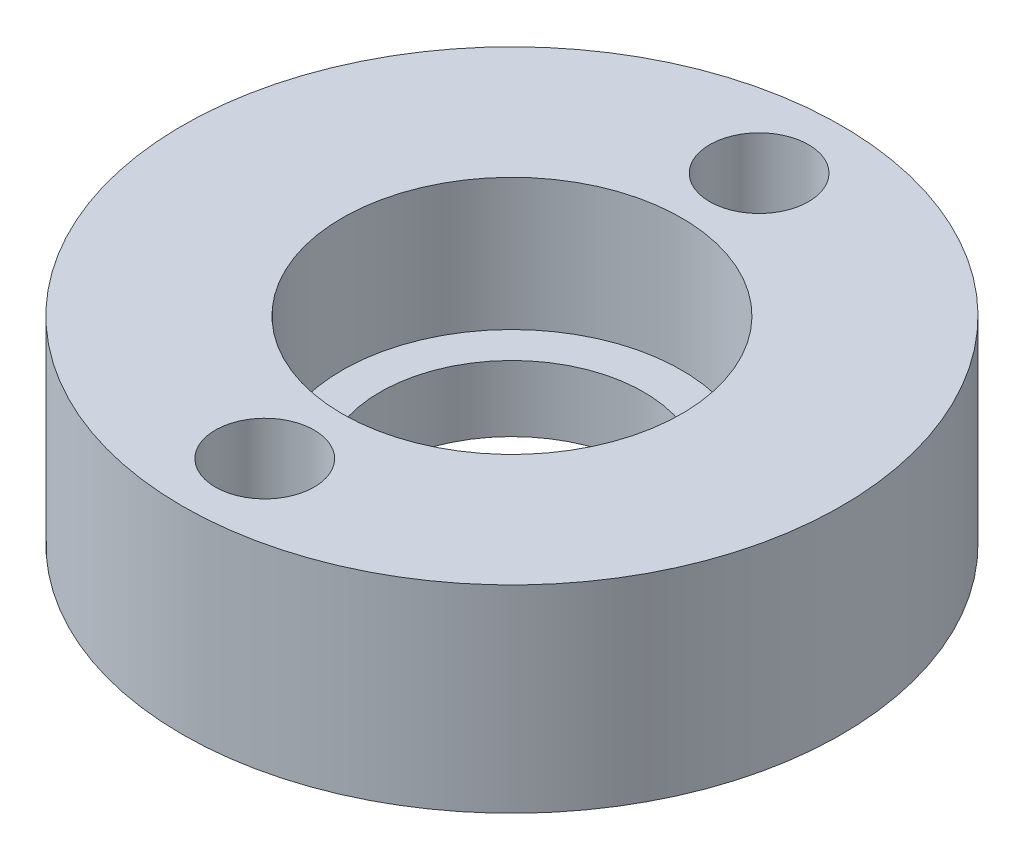
from build123d import *

# Parameters (mm, degrees)
SKETCH_1_R          = 10
SKETCH_1_R_2        = 1.5
SKETCH_1_R_3        = 4
EXTRUDE_1_DEPTH     = 6
SKETCH_2_R          = 5.15
CUT_EXTRUDE_1_DEPTH = 4


with BuildPart() as part:
    # Эскиз1 → Бобышка-Вытянуть1 (new body)
    with BuildSketch(Plane(origin=(0, 0, 0), x_dir=(1, 0, 0), z_dir=(0, 1, 0))):
        with Locations(Location((0, 0, 0), (0, 0, 270))):
            Circle(SKETCH_1_R)
        with Locations(Location((0, 7.5, 0), (0, 0, 270))):
            Circle(SKETCH_1_R_2, mode=Mode.SUBTRACT)
        with Locations(Location((0, -7.5, 0), (0, 0, 270))):
            Circle(SKETCH_1_R_2, mode=Mode.SUBTRACT)
        with Locations(Location((0, 0, 0), (0, 0, 270))):
            Circle(SKETCH_1_R_3, mode=Mode.SUBTRACT)
    extrude(amount=EXTRUDE_1_DEPTH)

    # Эскиз2 → Вырез-Вытянуть1 (cut)
    with BuildSketch(Plane(origin=(0, 6, 0), x_dir=(1, 0, 0), z_dir=(0, 1, 0))):
        with Locations(Location((0, 0, 0), (0, 0, 270))):
            Circle(SKETCH_2_R)
    extrude(amount=-CUT_EXTRUDE_1_DEPTH, mode=Mode.SUBTRACT)


solid = part.part
